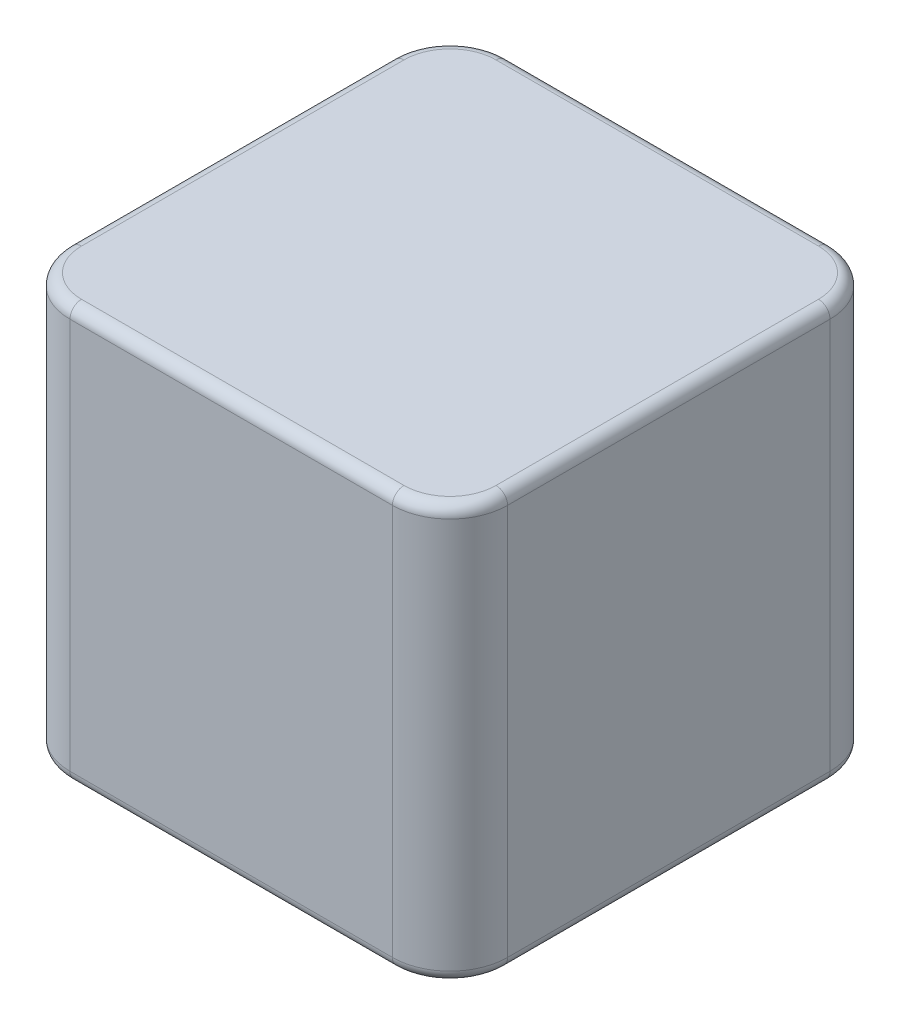
from build123d import *

# Parameters (mm, degrees)
SKETCH1_W           = 38
SKETCH1_H           = 38
BOSS_EXTRUDE1_DEPTH = 36
SKETCH3_R           = 7
CUT_EXTRUDE1_DEPTH  = 2
FILLET1_R           = 5
FILLET2_R           = 1


with BuildPart() as part:
    # Sketch1 → Boss-Extrude1 (new body)
    with BuildSketch(Plane(origin=(0, 0, 0), x_dir=(1, 0, 0), z_dir=(0, 1, 0))):
        Rectangle(SKETCH1_W, SKETCH1_H)
    extrude(amount=BOSS_EXTRUDE1_DEPTH)

    # Sketch3 → Cut-Extrude1 (cut)
    with BuildSketch(Plane.XZ):
        with Locations(Location((0, 0, 0), (0, 0, 270))):
            Circle(SKETCH3_R)
    extrude(amount=-CUT_EXTRUDE1_DEPTH, mode=Mode.SUBTRACT)

    # Fillet1
    fillet1_edges = [part.edges().sort_by_distance(p)[0] for p in [
        (19, 18, 19),
        (-19, 18, 19),
        (-19, 18, -19),
        (19, 18, -19),
    ]]
    fillet(fillet1_edges, radius=FILLET1_R)

    # Fillet2
    fillet2_edges = [part.edges().sort_by_distance(p)[0] for p in [
        (0, 0, -19),
        (0, 36, -19),
        (19, 0, 0),
        (0, 0, 19),
        (-19, 0, 0),
        (-17.535533906, 0, 17.535533906),
        (-17.535533906, 0, -17.535533906),
        (17.535533906, 0, 17.535533906),
        (17.535533906, 0, -17.535533906),
        (19, 36, 0),
        (-19, 36, 0),
        (0, 36, 19),
        (-17.535533906, 36, 17.535533906),
        (-17.535533906, 36, -17.535533906),
        (17.535533906, 36, 17.535533906),
        (17.535533906, 36, -17.535533906),
    ]]
    fillet(fillet2_edges, radius=FILLET2_R)


solid = part.part
